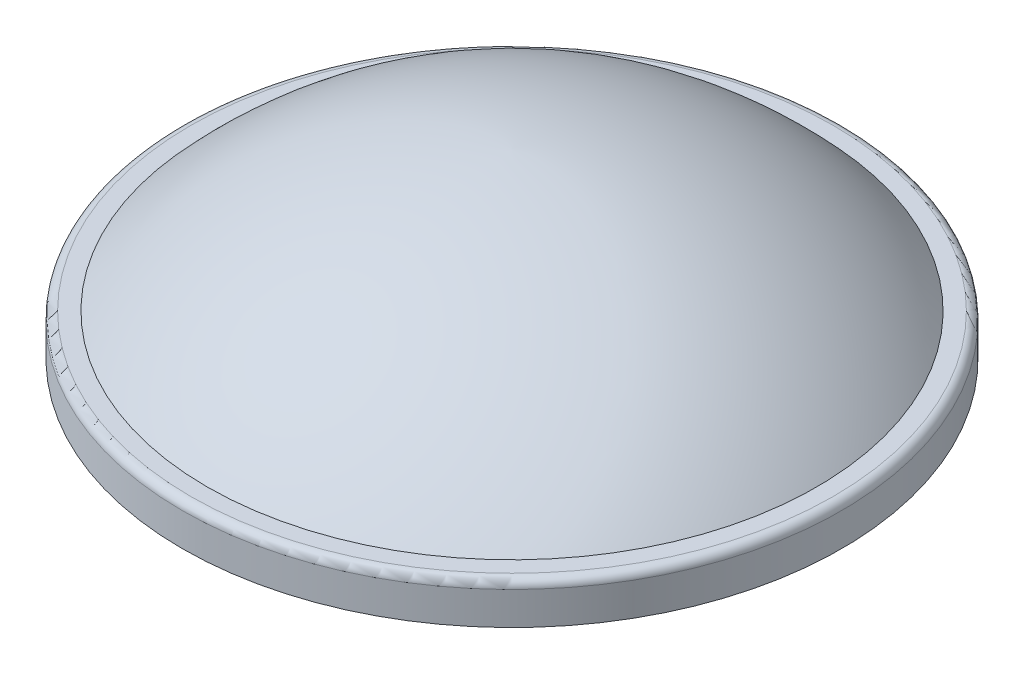
from build123d import *

# Parameters (mm, degrees)
CONG_1_R = 0.1


with BuildPart() as part:
    # Esquisse1 → Révolution1 (revolve)
    with BuildSketch(Plane.XY, mode=Mode.PRIVATE) as r_volution1_sk:
        with BuildLine():
            Line((0, 0), (-4, 0))
            Line((-4, 0), (-4, 0.5))
            Line((-4, 0.5), (-3.7, 0.5))
            ThreePointArc((-3.7, 0.5), (-2.021402808, 1.722555656), (0, 2.198225244))
            Line((0, 2.198225244), (0, 0))
        make_face()
    revolve(r_volution1_sk.sketch.rotate(Axis((0, -1.369247278, 0), (0, 1, 0)), 270), axis=Axis((0, -1.369247278, 0), (0, 1, 0)))

    # Congé1
    cong_1_edges = [part.edges().sort_by_distance(p)[0] for p in [
        (0, 0.5, 4),
    ]]
    fillet(cong_1_edges, radius=CONG_1_R)


solid = part.part
